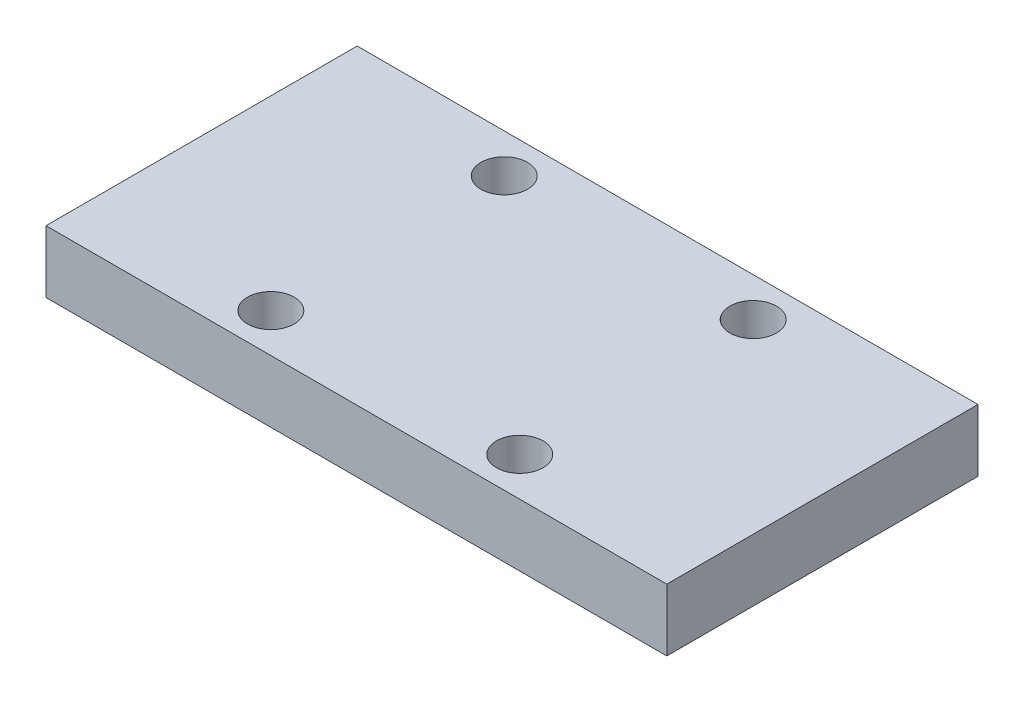
from build123d import *

# Parameters (mm, degrees)
SKETCH_1_W      = 39.9
SKETCH_1_H      = 20
SKETCH_1_R      = 1.5
EXTRUDE_1_DEPTH = 4


with BuildPart() as part:
    # 草图1 → 凸台-拉伸1 (new body)
    with BuildSketch(Plane(origin=(0, 0, 0), x_dir=(1, 0, 0), z_dir=(0, 1, 0))):
        Rectangle(SKETCH_1_W, SKETCH_1_H)
        with Locations(Location((8, 7.5, 0), (0, 0, 270))):
            Circle(SKETCH_1_R, mode=Mode.SUBTRACT)
        with Locations(Location((8, -7.5, 0), (0, 0, 90))):
            Circle(SKETCH_1_R, mode=Mode.SUBTRACT)
        with Locations(Location((-8, -7.5, 0), (0, 0, 270))):
            Circle(SKETCH_1_R, mode=Mode.SUBTRACT)
        with Locations(Location((-8, 7.5, 0), (0, 0, 90))):
            Circle(SKETCH_1_R, mode=Mode.SUBTRACT)
    extrude(amount=EXTRUDE_1_DEPTH)


solid = part.part
